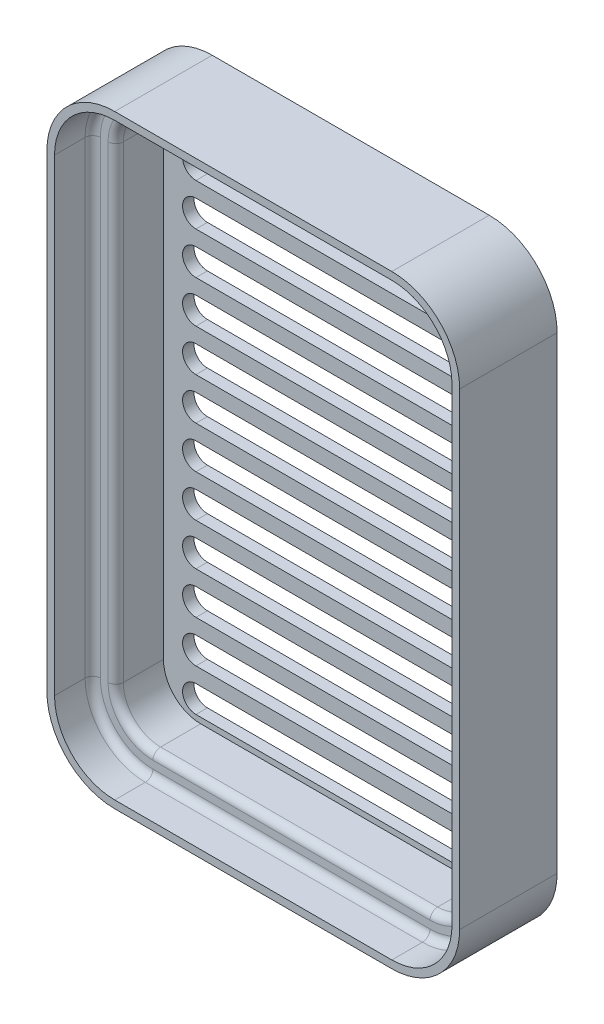
from build123d import *

# Parameters (mm, degrees)
BOSS_EXTRUDE1_DEPTH = 10.2
BOSS_EXTRUDE2_DEPTH = 1.2
BOSS_EXTRUDE3_DEPTH = 5
FILLET1_R           = 0.8
CUT_EXTRUDE3_REACH  = 70.238
LPATTERN1_COUNT     = 7
LPATTERN1_PITCH     = 4.4
LPATTERN1_COL_COUNT = 7
LPATTERN1_COL_PITCH = 4.4


with BuildPart() as part:
    # Sketch1 → Boss-Extrude1 (new body)
    with BuildSketch(Plane.XY):
        with BuildLine():
            Line((-21.6, 8), (-21.6, 57))
            ThreePointArc((-21.6, 57), (-19.520458146, 62.020458146), (-14.5, 64.1))
            Line((-14.5, 64.1), (14.5, 64.1))
            ThreePointArc((14.5, 64.1), (19.520458146, 62.020458146), (21.6, 57))
            Line((21.6, 57), (21.6, 8))
            ThreePointArc((21.6, 8), (19.520458146, 2.979541854), (14.5, 0.9))
            Line((14.5, 0.9), (-14.5, 0.9))
            ThreePointArc((-14.5, 0.9), (-19.520458146, 2.979541854), (-21.6, 8))
        make_face()
        with BuildLine():
            Line((-20.8, 8), (-20.8, 57))
            ThreePointArc((-20.8, 57), (-18.954772721, 61.454772721), (-14.5, 63.3))
            Line((-14.5, 63.3), (14.5, 63.3))
            ThreePointArc((14.5, 63.3), (18.954772721, 61.454772721), (20.8, 57))
            Line((20.8, 57), (20.8, 8))
            ThreePointArc((20.8, 8), (18.954772721, 3.545227279), (14.5, 1.7))
            Line((14.5, 1.7), (-14.5, 1.7))
            ThreePointArc((-14.5, 1.7), (-18.954772721, 3.545227279), (-20.8, 8))
        make_face(mode=Mode.SUBTRACT)
    extrude(amount=BOSS_EXTRUDE1_DEPTH)

    # Sketch2 → Boss-Extrude2 (add)
    with BuildSketch(Plane(origin=(0, 0, 0), x_dir=(-1, 0, 0), z_dir=(0, 0, -1))):
        with BuildLine():
            Line((-14.5, 63.3), (14.5, 63.3))
            ThreePointArc((14.5, 63.3), (18.954772721, 61.454772721), (20.8, 57))
            Line((20.8, 57), (20.8, 8))
            ThreePointArc((20.8, 8), (18.954772721, 3.545227279), (14.5, 1.7))
            Line((14.5, 1.7), (-14.5, 1.7))
            ThreePointArc((-14.5, 1.7), (-18.954772721, 3.545227279), (-20.8, 8))
            Line((-20.8, 8), (-20.8, 57))
            ThreePointArc((-20.8, 57), (-18.954772721, 61.454772721), (-14.5, 63.3))
        make_face()
    extrude(amount=-BOSS_EXTRUDE2_DEPTH)

    # Sketch3 → Boss-Extrude3 (add)
    with BuildSketch(Plane.XY.offset(1.2)):
        with BuildLine():
            Line((14.5, 1.7), (-14.5, 1.7))
            ThreePointArc((-14.5, 1.7), (-18.954772721, 3.545227279), (-20.8, 8))
            Line((-20.8, 8), (-20.8, 57))
            ThreePointArc((-20.8, 57), (-18.954772721, 61.454772721), (-14.5, 63.3))
            Line((-14.5, 63.3), (14.5, 63.3))
            ThreePointArc((14.5, 63.3), (18.954772721, 61.454772721), (20.8, 57))
            Line((20.8, 57), (20.8, 8))
            ThreePointArc((20.8, 8), (18.954772721, 3.545227279), (14.5, 1.7))
        make_face()
        with BuildLine():
            Line((-14.5, 4.1), (14.5, 4.1))
            ThreePointArc((14.5, 4.1), (17.257716447, 5.242283553), (18.4, 8))
            Line((18.4, 8), (18.4, 57))
            ThreePointArc((18.4, 57), (17.257716447, 59.757716447), (14.5, 60.9))
            Line((14.5, 60.9), (-14.5, 60.9))
            ThreePointArc((-14.5, 60.9), (-17.257716447, 59.757716447), (-18.4, 57))
            Line((-18.4, 57), (-18.4, 8))
            ThreePointArc((-18.4, 8), (-17.257716447, 5.242283553), (-14.5, 4.1))
        make_face(mode=Mode.SUBTRACT)
    extrude(amount=BOSS_EXTRUDE3_DEPTH)

    # Fillet1
    fillet1_edges = [part.edges().sort_by_distance(p)[0] for p in [
        (-18.954772721, 3.545227279, 6.2),
        (-20.8, 32.5, 6.2),
        (-18.954772721, 61.454772721, 6.2),
        (0, 63.3, 6.2),
        (18.954772721, 61.454772721, 6.2),
        (20.8, 32.5, 6.2),
        (18.954772721, 3.545227279, 6.2),
        (0, 1.7, 6.2),
        (-18.4, 32.5, 6.2),
        (0, 60.9, 6.2),
        (18.4, 32.5, 6.2),
        (0, 4.1, 6.2),
        (-17.257716447, 5.242283553, 6.2),
        (-17.257716447, 59.757716447, 6.2),
        (17.257716447, 59.757716447, 6.2),
        (17.257716447, 5.242283553, 6.2),
    ]]
    fillet(fillet1_edges, radius=FILLET1_R)

    # Sketch6 → Cut-Extrude3 (cut, up to next)
    with BuildSketch(Plane.XY.offset(1.2), mode=Mode.PRIVATE) as cut_extrude3_sk1:
        with BuildLine():
            Line((-15, 33.9), (15, 33.9))
            ThreePointArc((15, 33.9), (16.4, 32.5), (15, 31.1))
            Line((15, 31.1), (-15, 31.1))
            ThreePointArc((-15, 31.1), (-16.4, 32.5), (-15, 33.9))
        make_face()
    cut_extrude3_tool1 = extrude(cut_extrude3_sk1.sketch, amount=-CUT_EXTRUDE3_REACH, mode=Mode.PRIVATE) & part.part
    cut_extrude3 = cut_extrude3_tool1.solids().sort_by_distance((0, 32.5, 1.2))[0]
    add(cut_extrude3, mode=Mode.SUBTRACT)

    # LPattern1: Cut-Extrude3 ×7
    with Locations(*[(0, -i * LPATTERN1_PITCH, 0) for i in range(1, LPATTERN1_COUNT)]):
        add(cut_extrude3, mode=Mode.SUBTRACT)

    # LPattern1 col: Cut-Extrude3 ×7
    with Locations(*[(0, i * LPATTERN1_COL_PITCH, 0) for i in range(1, LPATTERN1_COL_COUNT)]):
        add(cut_extrude3, mode=Mode.SUBTRACT)


solid = part.part
